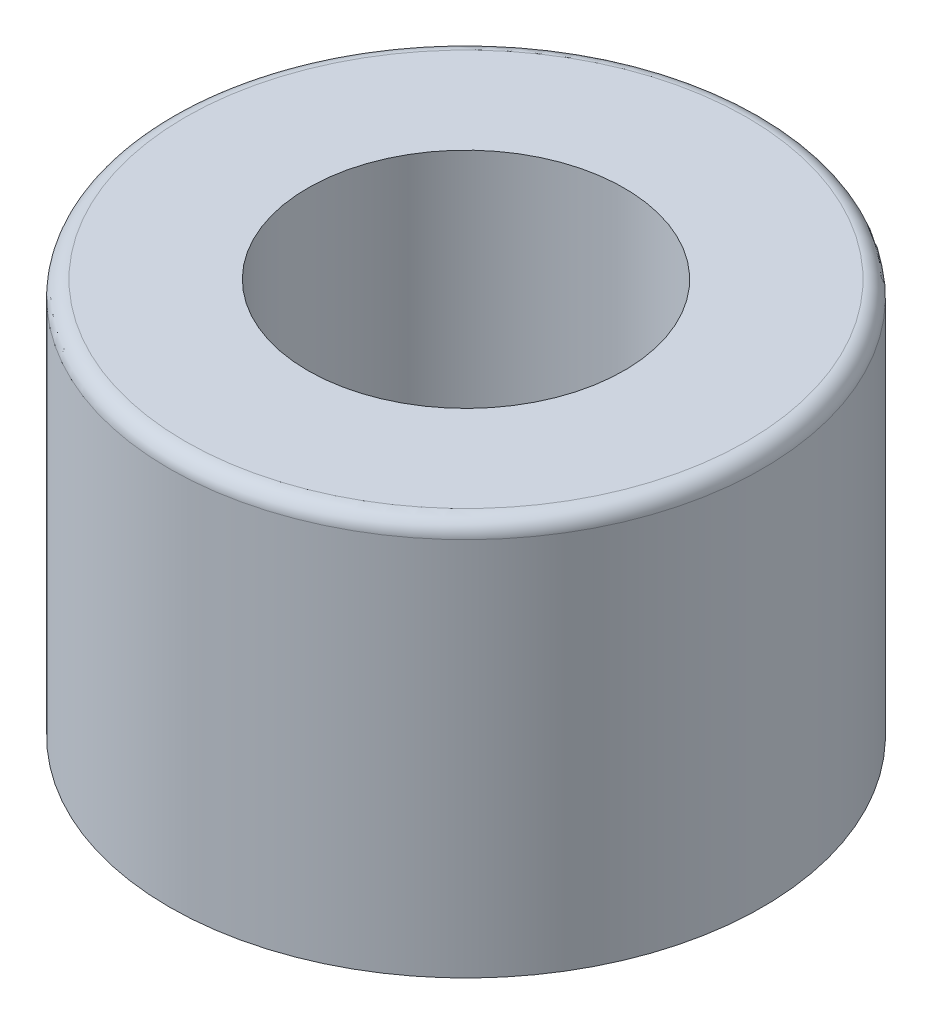
from build123d import *

# Parameters (mm, degrees)
SKETCH1_R           = 4.7625
SKETCH1_R_2         = 2.54
BOSS_EXTRUDE1_DEPTH = 6.35
FILLET1_R           = 0.254


with BuildPart() as part:
    # Sketch1 → Boss-Extrude1 (new body)
    with BuildSketch(Plane(origin=(0, 0, 0), x_dir=(1, 0, 0), z_dir=(0, 1, 0))):
        with Locations(Location((0, 0, 0), (0, 0, 270))):
            Circle(SKETCH1_R)
        with Locations(Location((0, 0, 0), (0, 0, 270))):
            Circle(SKETCH1_R_2, mode=Mode.SUBTRACT)
    extrude(amount=BOSS_EXTRUDE1_DEPTH)

    # Fillet1
    fillet1_edges = [part.edges().sort_by_distance(p)[0] for p in [
        (0, 6.35, -4.7625),
    ]]
    fillet(fillet1_edges, radius=FILLET1_R)


solid = part.part
